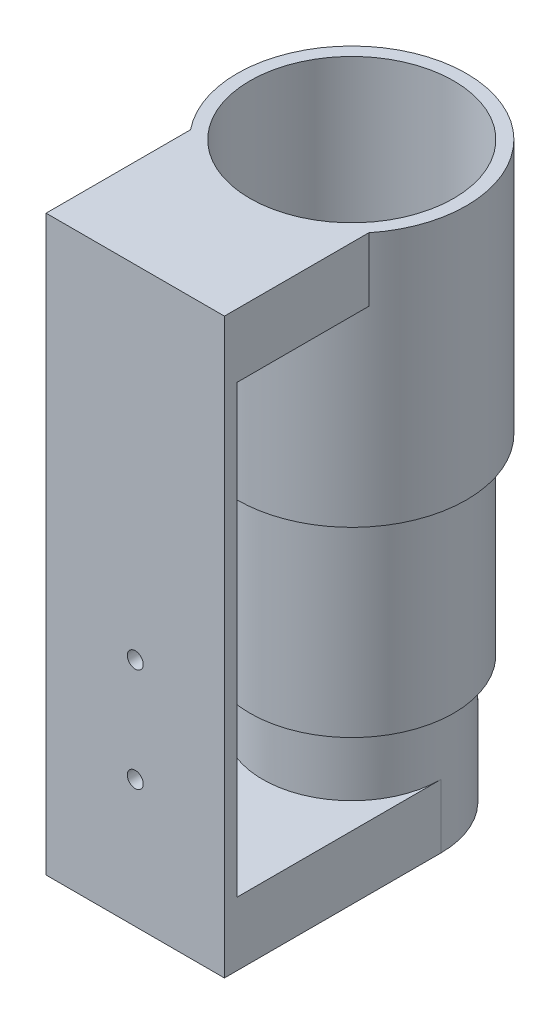
from build123d import *

# Parameters (mm, degrees)
SKETCH1_R           = 15.24
SKETCH1_W           = 7.62
SKETCH1_H           = 7.62
BOSS_EXTRUDE1_DEPTH = 6.35
SKETCH2_R           = 17.78
SKETCH2_R_2         = 15.24
BOSS_EXTRUDE2_DEPTH = 25.4
SKETCH5_R           = 20.32
SKETCH5_R_2         = 17.78
BOSS_EXTRUDE3_DEPTH = 38.1
SKETCH6_R           = 22.86
SKETCH6_R_2         = 20.32
BOSS_EXTRUDE4_DEPTH = 50.8
BOSS_EXTRUDE5_DEPTH = 12.7
BOSS_EXTRUDE6_DEPTH = 2.54
BOSS_EXTRUDE7_DEPTH = 12.7
SKETCH13_R          = 1.5875
CUT_EXTRUDE1_DEPTH  = 10.16


with BuildPart() as part:
    # Sketch1 → Boss-Extrude1 (new body)
    with BuildSketch(Plane(origin=(0, 0, 0), x_dir=(1, 0, 0), z_dir=(0, 1, 0))):
        with Locations(Location((0, 0, 0), (0, 0, 270))):
            Circle(SKETCH1_R)
        Rectangle(SKETCH1_W, SKETCH1_H, mode=Mode.SUBTRACT)
    extrude(amount=BOSS_EXTRUDE1_DEPTH)

    # Sketch2 → Boss-Extrude2 (add)
    with BuildSketch(Plane(origin=(0, 0, 0), x_dir=(1, 0, 0), z_dir=(0, 1, 0))):
        with Locations(Location((0, 0, 0), (0, 0, 270))):
            Circle(SKETCH2_R)
        with Locations(Location((0, 0, 0), (0, 0, 270))):
            Circle(SKETCH2_R_2, mode=Mode.SUBTRACT)
    extrude(amount=BOSS_EXTRUDE2_DEPTH)

    # Sketch7 → Boss-Extrude5 (add)
    with BuildSketch(Plane(origin=(0, 0, 0), x_dir=(1, 0, 0), z_dir=(0, 1, 0))):
        with BuildLine():
            Line((-17.78, -43.180524941), (17.78, -43.180524941))
            Line((17.78, -43.180524941), (17.78, 0))
            ThreePointArc((17.78, 0), (0, -17.78), (-17.78, 0))
            Line((-17.78, 0), (-17.78, -43.180524941))
        make_face()
    extrude(amount=BOSS_EXTRUDE5_DEPTH)

    # Sketch9 → Boss-Extrude6 (add)
    with BuildSketch(Plane.XY.offset(43.180524941)):
        Polygon((-17.78, 12.7), (-17.78, 114.3), (17.78, 114.3), (17.78, 12.7), (17.78, 0), (-17.78, 0), align=None)
    extrude(amount=-BOSS_EXTRUDE6_DEPTH)



with BuildPart() as body_2:
    # Sketch5 → Boss-Extrude3 (new body)
    with BuildSketch(Plane(origin=(0, 25.4, 0), x_dir=(1, 0, 0), z_dir=(0, 1, 0))):
        with Locations(Location((0, 0, 0), (0, 0, 90))):
            Circle(SKETCH5_R)
        with Locations(Location((0, 0, 0), (0, 0, 90))):
            Circle(SKETCH5_R_2, mode=Mode.SUBTRACT)
    extrude(amount=BOSS_EXTRUDE3_DEPTH)


with BuildPart() as body_3:
    # Sketch6 → Boss-Extrude4 (new body)
    with BuildSketch(Plane(origin=(0, 63.5, 0), x_dir=(1, 0, 0), z_dir=(0, 1, 0))):
        with Locations(Location((0, 0, 0), (0, 0, 270))):
            Circle(SKETCH6_R)
        with Locations(Location((0, 0, 0), (0, 0, 270))):
            Circle(SKETCH6_R_2, mode=Mode.SUBTRACT)
    extrude(amount=BOSS_EXTRUDE4_DEPTH)


with BuildPart() as part_1:
    add(part.part)

    add(body_3.part)  # Boss-Extrude7 merges body 3
    # Sketch10 → Boss-Extrude7 (add)
    with BuildSketch(Plane(origin=(0, 114.3, 0), x_dir=(1, 0, 0), z_dir=(0, 1, 0))):
        with BuildLine():
            Line((-17.78, -40.640524941), (-17.78, -14.368409794))
            ThreePointArc((-17.78, -14.368409794), (0, -22.86), (17.78, -14.368409794))
            Line((17.78, -14.368409794), (17.78, -40.640524941))
            Line((17.78, -40.640524941), (-17.78, -40.640524941))
        make_face()
    extrude(amount=-BOSS_EXTRUDE7_DEPTH)

    # Sketch13 → Cut-Extrude1 (cut)
    with BuildSketch(Plane.XY.offset(43.180524941)):
        with Locations((0, 25.4)):
            Circle(SKETCH13_R)
        with Locations((0, 46.0375)):
            Circle(SKETCH13_R)
    extrude(amount=-CUT_EXTRUDE1_DEPTH, mode=Mode.SUBTRACT)


solid = Compound([body_2.part, part_1.part])
